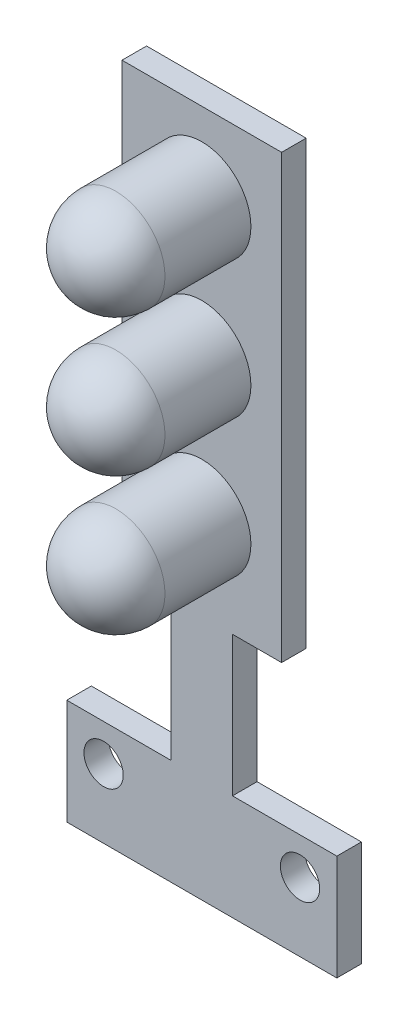
from build123d import *

# Parameters (mm, degrees)
CROQUIS1_R              = 1.6
SALIENTE_EXTRUIR1_DEPTH = 2
CROQUIS2_R              = 4
SALIENTE_EXTRUIR2_DEPTH = 11
REDONDEO1_R             = 4
REDONDEO2_R             = 4


with BuildPart() as part:
    # Croquis1 → Saliente-Extruir1 (new body)
    with BuildSketch(Plane.XY):
        Polygon((-6.5, 28), (-6.5, -8), (-2.5, -8), (-2.5, -19.4), (-11, -19.4), (-11, -28), (11, -28), (11, -19.4), (2.5, -19.4), (2.5, -8), (6.5, -8), (6.5, 28), align=None)
        with Locations((-8, -22.4)):
            Circle(CROQUIS1_R, mode=Mode.SUBTRACT)
        with Locations((8, -22.4)):
            Circle(CROQUIS1_R, mode=Mode.SUBTRACT)
    extrude(amount=SALIENTE_EXTRUIR1_DEPTH)

    # Croquis2 → Saliente-Extruir2 (add)
    with BuildSketch(Plane.XY.offset(2)):
        with Locations((0, 21.5)):
            Circle(CROQUIS2_R)
        with Locations((0, 10.3)):
            Circle(CROQUIS2_R)
        with Locations((0, -0.9)):
            Circle(CROQUIS2_R)
    extrude(amount=SALIENTE_EXTRUIR2_DEPTH)

    # Redondeo1
    redondeo1_edges = [part.edges().sort_by_distance(p)[0] for p in [
        (-4, 21.5, 13),
    ]]
    fillet(redondeo1_edges, radius=REDONDEO1_R)

    # Redondeo2
    redondeo2_edges = [part.edges().sort_by_distance(p)[0] for p in [
        (-4, 10.3, 13),
        (-4, -0.9, 13),
    ]]
    fillet(redondeo2_edges, radius=REDONDEO2_R)


solid = part.part
